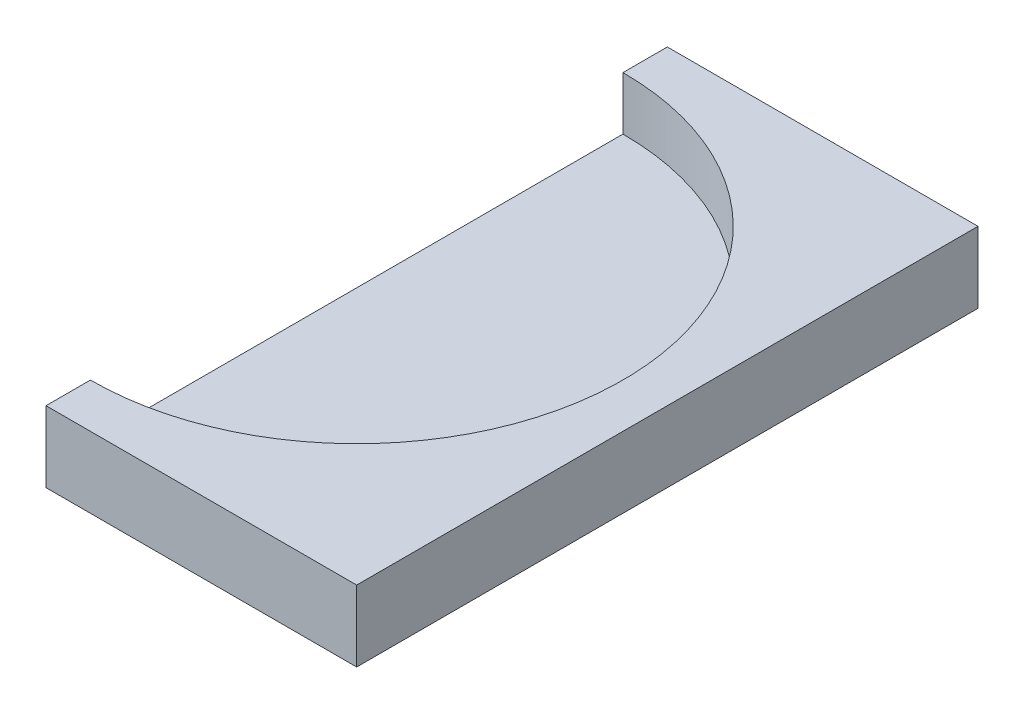
from build123d import *

# Parameters (mm, degrees)
SKETCH_1_W          = 35
SKETCH_1_H          = 70
EXTRUDE_1_DEPTH     = 8
SKETCH_2_R          = 30
CUT_EXTRUDE_1_DEPTH = 6


with BuildPart() as part:
    # Эскиз1 → Бобышка-Вытянуть1 (new body)
    with BuildSketch(Plane(origin=(0, 0, 0), x_dir=(1, 0, 0), z_dir=(0, 1, 0))):
        Rectangle(SKETCH_1_W, SKETCH_1_H)
    extrude(amount=EXTRUDE_1_DEPTH)

    # Эскиз2 → Вырез-Вытянуть1 (cut)
    with BuildSketch(Plane(origin=(0, 8, 0), x_dir=(1, 0, 0), z_dir=(0, 1, 0))):
        with Locations((-17.5, 0)):
            Circle(SKETCH_2_R)
    extrude(amount=-CUT_EXTRUDE_1_DEPTH, mode=Mode.SUBTRACT)


solid = part.part
